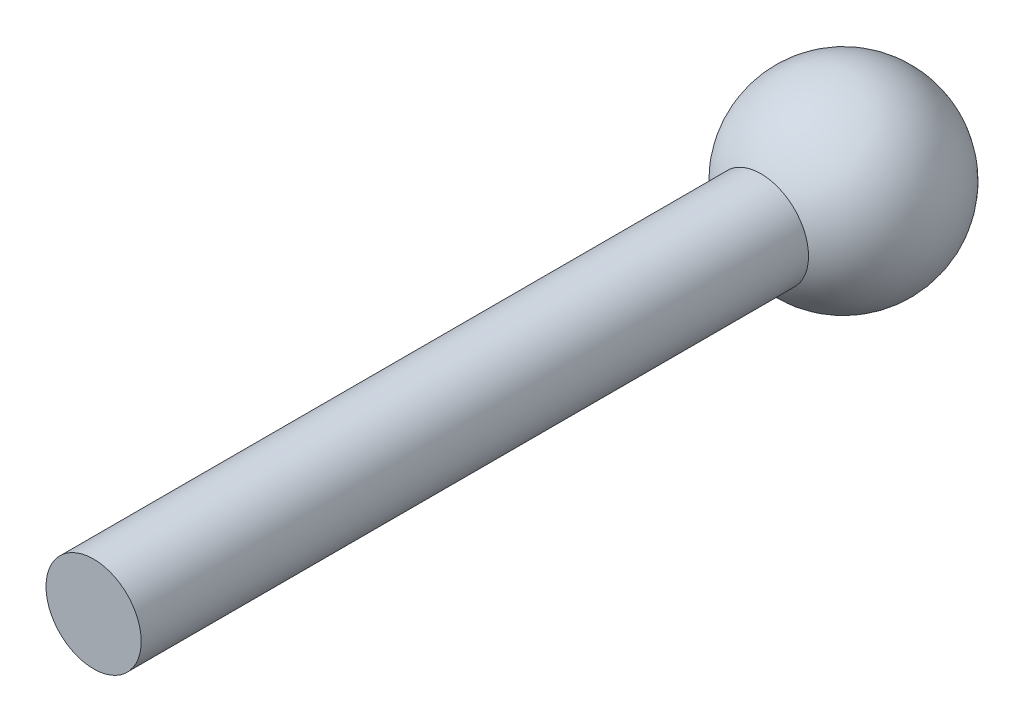
from build123d import *

# Parameters (mm, degrees)
SKETCH_1_R      = 5
EXTRUDE_1_DEPTH = 75


with BuildPart() as part:
    # 草图1 → 凸台-拉伸1 (new body)
    with BuildSketch(Plane.XY):
        Circle(SKETCH_1_R)
    extrude(amount=EXTRUDE_1_DEPTH)

    # 草图4 → 旋转29 (revolve)
    with BuildSketch(Plane(origin=(0, 0, 0), x_dir=(1, 0, 0), z_dir=(0, 1, 0))):
        with BuildLine():
            Line((0, 13.768068936), (0, -6.231931064))
            ThreePointArc((0, -6.231931064), (10, 3.768068936), (0, 13.768068936))
        make_face()
    revolve(axis=Axis((0, 0, -13.768068936), (0, 0, 1)))


solid = part.part
